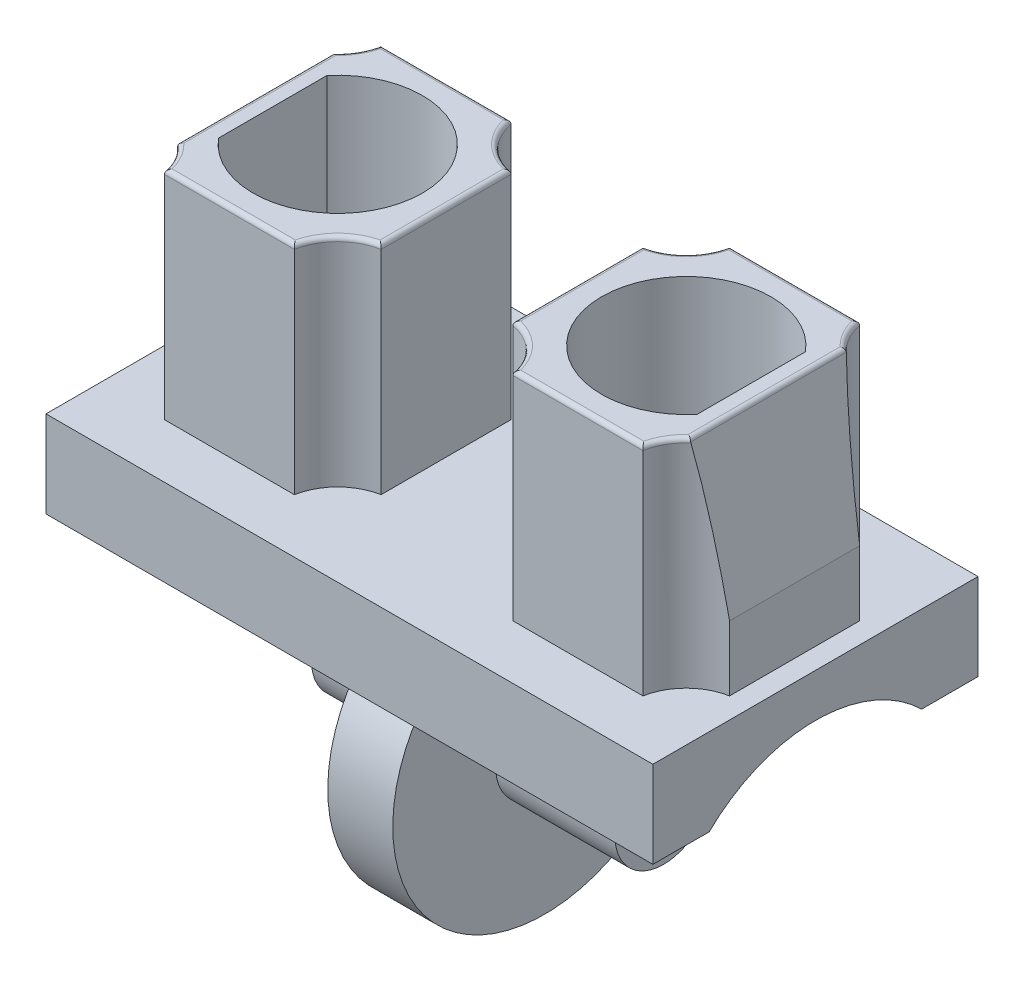
from build123d import *

# Parameters (mm, degrees)
SKETCH1_R           = 3.5
BOSS_EXTRUDE1_DEPTH = 14
SKETCH2_W           = 7.5
SKETCH2_H           = 2
BOSS_EXTRUDE2_DEPTH = 14
CUT_EXTRUDE1_START  = -6.25
SKETCH4_R           = 3.5
SKETCH4_R_2         = 1.125
CUT_EXTRUDE1_DEPTH  = 6.25
SKETCH5_R           = 3.5
SKETCH5_R_2         = 1.125
CUT_EXTRUDE2_DEPTH  = 6.25
CUT_EXTRUDE3_DEPTH  = 17.507574019
SKETCH7_W           = 5
SKETCH7_H           = 5
BOSS_EXTRUDE3_DEPTH = 5
CUT_EXTRUDE4_DEPTH  = 19.506755523
CUT_EXTRUDE5_DEPTH  = 5
FILLET1_R           = 0.1
CUT_EXTRUDE6_DEPTH  = 5


with BuildPart() as part:
    # Sketch1 → Boss-Extrude1 (new body)
    with BuildSketch(Plane(origin=(0, 0, 0), x_dir=(0, 0, -1), z_dir=(1, 0, 0))):
        Circle(SKETCH1_R)
    extrude(amount=BOSS_EXTRUDE1_DEPTH)

    # Sketch2 → Boss-Extrude2 (add)
    with BuildSketch(Plane(origin=(0, 0, 0), x_dir=(0, 0, -1), z_dir=(1, 0, 0))):
        with Locations((0, 3.5)):
            Rectangle(SKETCH2_W, SKETCH2_H)
    extrude(amount=BOSS_EXTRUDE2_DEPTH)

    # Sketch4 → Cut-Extrude1 (cut)
    with BuildSketch(Plane(origin=(14, 0, 0), x_dir=(0, 0, -1), z_dir=(1, 0, 0)).offset(CUT_EXTRUDE1_START)):
        Circle(SKETCH4_R)
        Circle(SKETCH4_R_2, mode=Mode.SUBTRACT)
    extrude(amount=CUT_EXTRUDE1_DEPTH, mode=Mode.SUBTRACT)

    # Sketch5 → Cut-Extrude2 (cut)
    with BuildSketch(Plane.ZY):
        Circle(SKETCH5_R)
        with Locations(Location((0, 0, 0), (0, 0, 180))):
            Circle(SKETCH5_R_2, mode=Mode.SUBTRACT)
    extrude(amount=-CUT_EXTRUDE2_DEPTH, mode=Mode.SUBTRACT)

    # Sketch6 → Cut-Extrude3 (cut, through all)
    with BuildSketch(Plane.XY.offset(3.75)):
        Polygon((0, -1.495013081), (0, 1.709332254), (4.5, 1.709332254), (4.5, 0.875), (3.5, 0.875), (3.5, -1.495013081), align=None)
        Polygon((10.5, 0.875), (10.5, -1.495013081), (14, -1.495013081), (14, 1.709332254), (9.5, 1.709332254), (9.5, 0.875), align=None)
    extrude(amount=-CUT_EXTRUDE3_DEPTH, mode=Mode.SUBTRACT)

    # Sketch7 → Boss-Extrude3 (add)
    with BuildSketch(Plane(origin=(0, 4.5, 0), x_dir=(1, 0, 0), z_dir=(0, 1, 0))):
        with Locations((2.98, 0)):
            Rectangle(SKETCH7_W, SKETCH7_H)
        with Locations((11.02, 0)):
            Rectangle(SKETCH7_W, SKETCH7_H)
    extrude(amount=BOSS_EXTRUDE3_DEPTH)

    # Sketch8 → Cut-Extrude4 (cut, through all)
    with BuildSketch(Plane.XY.offset(3.75)):
        Polygon((2.157769387, 15.515103022), (0.48, 15.515103022), (0.48, 6), align=None)
        Polygon((13.52, 6), (11.842230613, 15.515103022), (13.52, 15.515103022), align=None)
    extrude(amount=-CUT_EXTRUDE4_DEPTH, mode=Mode.SUBTRACT)

    # Sketch9 → Cut-Extrude5 (cut)
    with BuildSketch(Plane(origin=(0, 9.5, 0), x_dir=(1, 0, 0), z_dir=(0, 1, 0))):
        with BuildLine():
            Line((4.48, 2.5), (5.48, 2.5))
            Line((5.48, 2.5), (5.48, 1.5))
            ThreePointArc((5.48, 1.5), (4.82498551, 1.84498551), (4.48, 2.5))
        make_face()
        with BuildLine():
            Line((0.48, 2.5), (0.48, 1.5))
            ThreePointArc((0.48, 1.5), (1.13501449, 1.84498551), (1.48, 2.5))
            Line((1.48, 2.5), (0.48, 2.5))
        make_face()
        with BuildLine():
            Line((5.48, -2.5), (5.48, -1.5))
            ThreePointArc((5.48, -1.5), (4.82498551, -1.84498551), (4.48, -2.5))
            Line((4.48, -2.5), (5.48, -2.5))
        make_face()
        with BuildLine():
            Line((0.48, -2.5), (0.48, -1.5))
            ThreePointArc((0.48, -1.5), (1.13501449, -1.84498551), (1.48, -2.5))
            Line((1.48, -2.5), (0.48, -2.5))
        make_face()
        with BuildLine():
            Line((8.52, -2.5), (8.52, -1.5))
            ThreePointArc((8.52, -1.5), (9.17501449, -1.84498551), (9.52, -2.5))
            Line((9.52, -2.5), (8.52, -2.5))
        make_face()
        with BuildLine():
            Line((12.52, -2.5), (13.52, -2.5))
            Line((13.52, -2.5), (13.52, -1.5))
            ThreePointArc((13.52, -1.5), (12.86498551, -1.84498551), (12.52, -2.5))
        make_face()
        with BuildLine():
            Line((13.52, 2.5), (13.52, 1.5))
            ThreePointArc((13.52, 1.5), (12.86498551, 1.84498551), (12.52, 2.5))
            Line((12.52, 2.5), (13.52, 2.5))
        make_face()
        with BuildLine():
            Line((8.52, 2.5), (8.52, 1.5))
            ThreePointArc((8.52, 1.5), (9.17501449, 1.84498551), (9.52, 2.5))
            Line((9.52, 2.5), (8.52, 2.5))
        make_face()
    extrude(amount=-CUT_EXTRUDE5_DEPTH, mode=Mode.SUBTRACT)

    # Fillet1
    fillet1_edges = [part.edges().sort_by_distance(p)[0] for p in [
        (1.097144432, 9.5, 0),
        (2.98, 9.5, -2.5),
        (4.82498551, 9.5, -1.84498551),
        (5.48, 9.5, 0),
        (4.82498551, 9.5, 1.84498551),
        (2.98, 9.5, 2.5),
        (8.52, 9.5, 0),
        (9.17501449, 9.5, -1.84498551),
        (11.02, 9.5, -2.5),
        (12.902855568, 9.5, 0),
        (11.02, 9.5, 2.5),
        (9.17501449, 9.5, 1.84498551),
        (1.344642616, 9.5, -2.123284662),
        (1.344642616, 9.5, 2.123284662),
        (12.655357384, 9.5, -2.123284662),
        (12.655357384, 9.5, 2.123284662),
    ]]
    fillet(fillet1_edges, radius=FILLET1_R)

    # Sketch10 → Cut-Extrude6 (cut)
    with BuildSketch(Plane(origin=(0, 9.5, 0), x_dir=(1, 0, 0), z_dir=(0, 1, 0))):
        with BuildLine():
            Line((1.48, 1.25), (1.48, -1.25))
            ThreePointArc((1.48, -1.25), (4.932562419, 0), (1.48, 1.25))
        make_face()
        with BuildLine():
            Line((12.52, 1.25), (12.52, -1.25))
            ThreePointArc((12.52, -1.25), (9.067437581, 0), (12.52, 1.25))
        make_face()
    extrude(amount=-CUT_EXTRUDE6_DEPTH, mode=Mode.SUBTRACT)


solid = part.part
